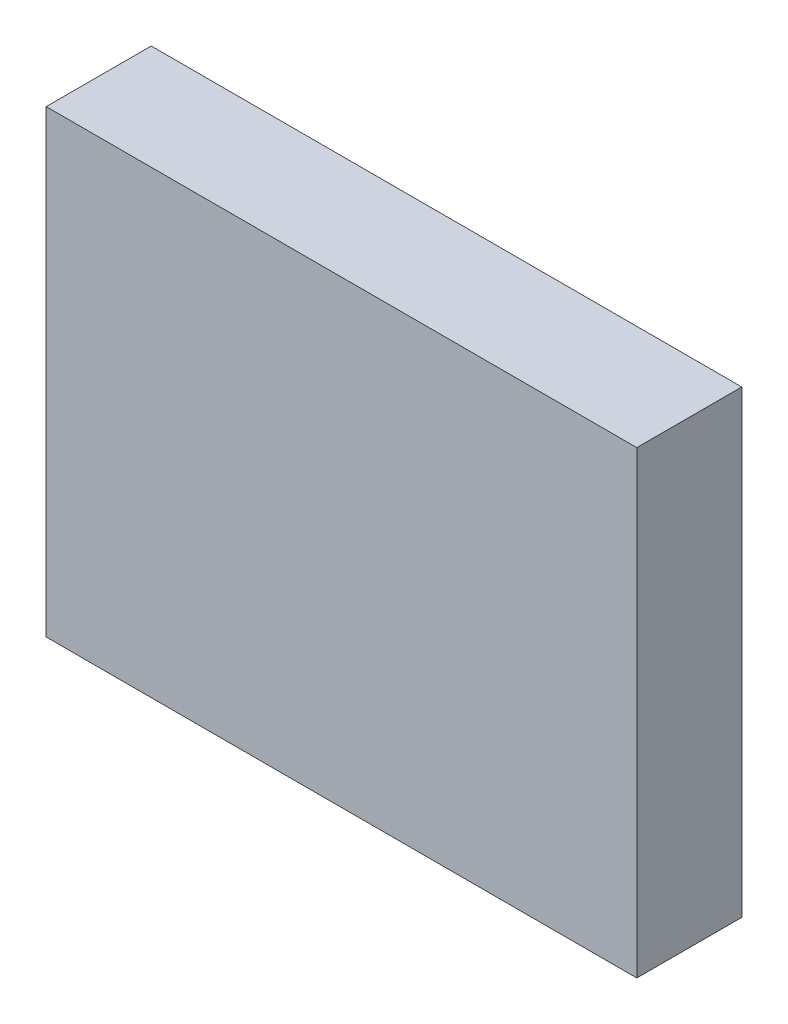
from build123d import *

# Parameters (mm, degrees)
SKETCH_1_W      = 90
SKETCH_1_H      = 70
EXTRUDE_1_DEPTH = 16


with BuildPart() as part:
    # 草圖1 → 填料-伸長1 (new body)
    with BuildSketch(Plane.XY):
        with Locations((32.093642939, -6.161971831)):
            Rectangle(SKETCH_1_W, SKETCH_1_H)
    extrude(amount=EXTRUDE_1_DEPTH)


solid = part.part
